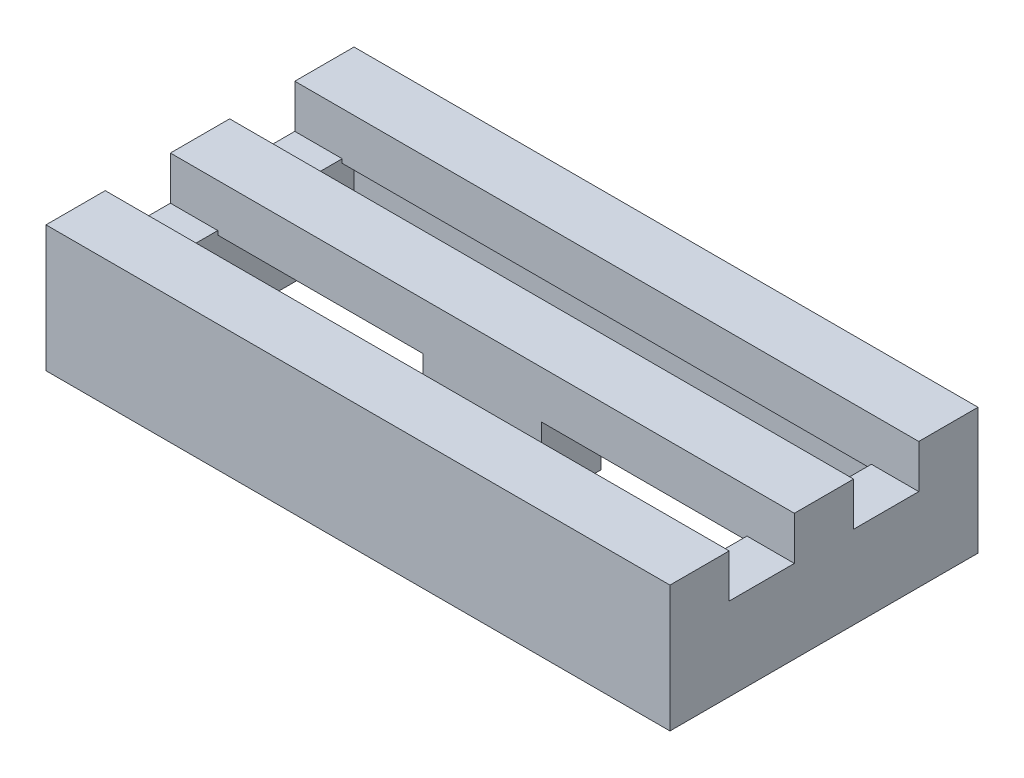
from build123d import *

# Parameters (mm, degrees)
SKETCH1_W           = 15.8
SKETCH1_H           = 3.2
BOSS_EXTRUDE1_DEPTH = 7.8
SHELL1_T            = -1.2
SKETCH3_W           = 15.8
SKETCH3_H           = 1.65
CUT_EXTRUDE1_DEPTH  = 1.1
LPATTERN1_COUNT     = 2
LPATTERN1_PITCH     = 3.15
SKETCH5_W           = 13.4
SKETCH5_H           = 1.65
CUT_EXTRUDE2_DEPTH  = 18.74514018
LPATTERN2_COUNT     = 2
LPATTERN2_PITCH     = 3.15
SKETCH7_W           = 3
SKETCH7_H           = 1.5
BOSS_EXTRUDE2_DEPTH = 1.8


with BuildPart() as part:
    # Sketch1 → Boss-Extrude1 (new body)
    with BuildSketch(Plane.XY):
        with Locations((7.9, 1.6)):
            Rectangle(SKETCH1_W, SKETCH1_H)
    extrude(amount=-BOSS_EXTRUDE1_DEPTH)

    # Shell1
    shell1_openings = [part.faces().sort_by_distance(p)[0] for p in [
        (7.9, 0, -3.9),
    ]]
    offset(amount=SHELL1_T, openings=shell1_openings, kind=Kind.INTERSECTION)

    # Sketch3 → Cut-Extrude1 (cut)
    with BuildSketch(Plane(origin=(0, 3.2, 0), x_dir=(1, 0, 0), z_dir=(0, 1, 0))):
        with Locations((7.9, 5.475)):
            Rectangle(SKETCH3_W, SKETCH3_H)
    cut_extrude1 = extrude(amount=-CUT_EXTRUDE1_DEPTH, mode=Mode.SUBTRACT)

    # LPattern1: Cut-Extrude1 ×2
    with Locations(*[(0, 0, i * LPATTERN1_PITCH) for i in range(1, LPATTERN1_COUNT)]):
        add(cut_extrude1, mode=Mode.SUBTRACT)

    # Sketch5 → Cut-Extrude2 (cut, through all)
    with BuildSketch(Plane(origin=(0, 2.1, 0), x_dir=(1, 0, 0), z_dir=(0, 1, 0))):
        with Locations((7.9, 5.475)):
            Rectangle(SKETCH5_W, SKETCH5_H)
    cut_extrude2 = extrude(amount=-CUT_EXTRUDE2_DEPTH, mode=Mode.SUBTRACT)

    # LPattern2: Cut-Extrude2 ×2
    with Locations(*[(0, 0, i * LPATTERN2_PITCH) for i in range(1, LPATTERN2_COUNT)]):
        add(cut_extrude2, mode=Mode.SUBTRACT)

    # Sketch7 → Boss-Extrude2 (add)
    with BuildSketch(Plane.XZ.offset(-2)):
        with Locations((7.9, -3.9)):
            Rectangle(SKETCH7_W, SKETCH7_H)
    extrude(amount=BOSS_EXTRUDE2_DEPTH)


solid = part.part
